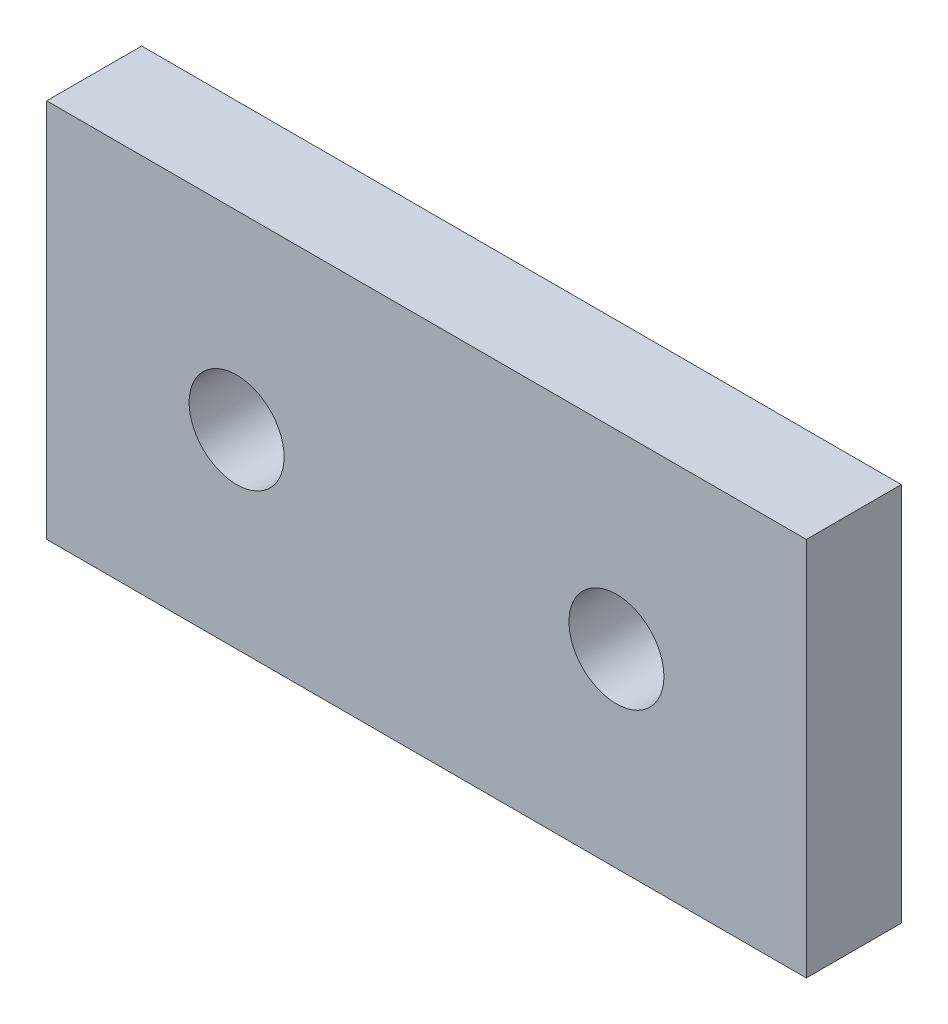
from build123d import *

# Parameters (mm, degrees)
SKETCH_1_W          = 80
SKETCH_1_H          = 40
EXTRUDE_1_DEPTH     = 10
SKETCH_2_R          = 5
CUT_EXTRUDE_1_DEPTH = 91


with BuildPart() as part:
    # 草图1 → 凸台-拉伸1 (new body)
    with BuildSketch(Plane.XY.offset(-5)):
        with Locations((40, 20)):
            Rectangle(SKETCH_1_W, SKETCH_1_H)
    extrude(amount=EXTRUDE_1_DEPTH)

    # 草图2 → 切除-拉伸1 (cut, through all)
    with BuildSketch(Plane.XY.offset(5)):
        with Locations((20, 20)):
            Circle(SKETCH_2_R)
        with Locations((60, 20)):
            Circle(SKETCH_2_R)
    extrude(amount=-CUT_EXTRUDE_1_DEPTH, mode=Mode.SUBTRACT)


solid = part.part
